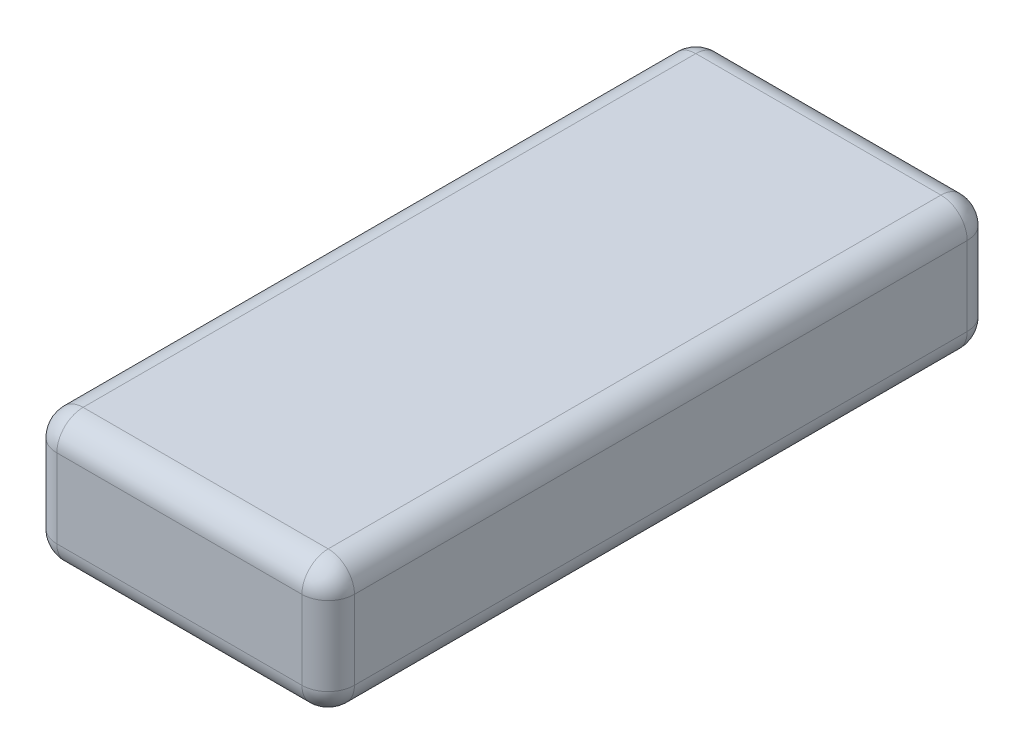
from build123d import *

# Parameters (mm, degrees)
SKETCH1_W           = 34
SKETCH1_H           = 76
BOSS_EXTRUDE1_DEPTH = 15
FILLET1_R           = 3


with BuildPart() as part:
    # Sketch1 → Boss-Extrude1 (new body)
    with BuildSketch(Plane(origin=(0, 0, 0), x_dir=(1, 0, 0), z_dir=(0, 1, 0))):
        Rectangle(SKETCH1_W, SKETCH1_H)
    extrude(amount=BOSS_EXTRUDE1_DEPTH)

    # Fillet1
    fillet1_edges = [part.edges().sort_by_distance(p)[0] for p in [
        (-17, 15, 0),
        (0, 15, 38),
        (17, 15, 0),
        (0, 0, 38),
        (-17, 0, 0),
        (0, 0, -38),
        (17, 0, 0),
        (0, 15, -38),
        (17, 7.5, 38),
        (-17, 7.5, 38),
        (-17, 7.5, -38),
        (17, 7.5, -38),
    ]]
    fillet(fillet1_edges, radius=FILLET1_R)


solid = part.part
